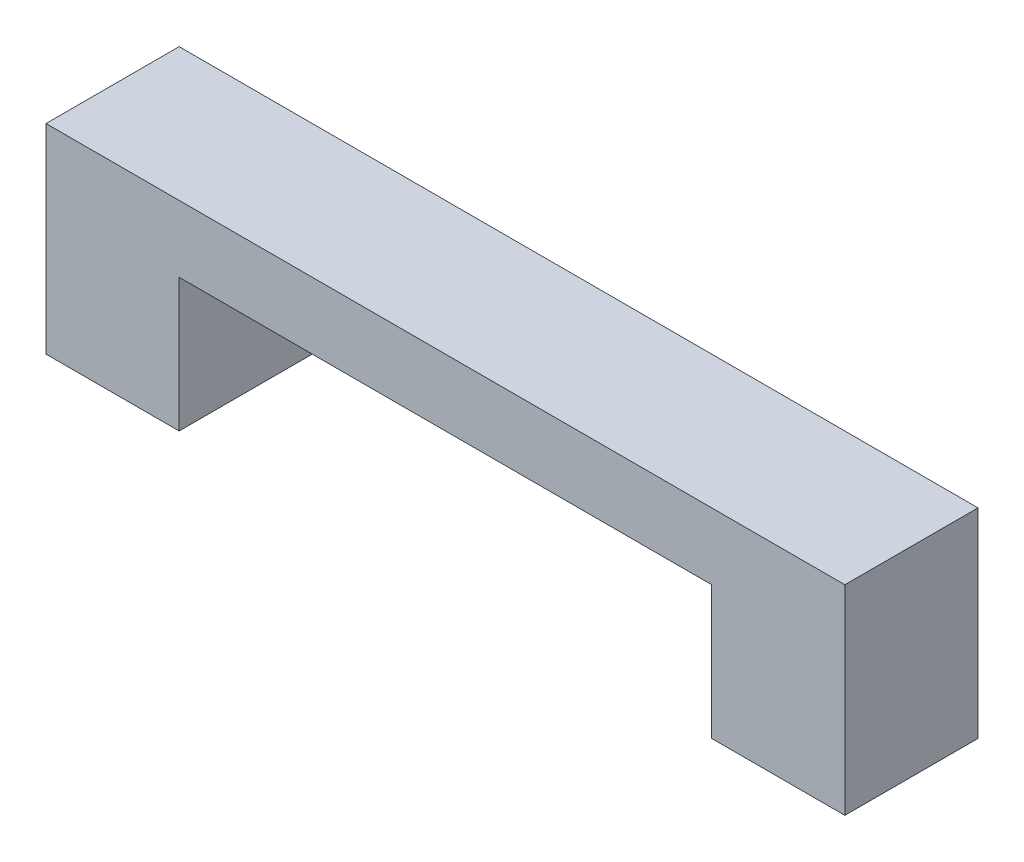
from build123d import *

# Parameters (mm, degrees)
BOSS_EXTRU_1_DEPTH = 2


with BuildPart() as part:
    # Esquisse1 → Boss.-Extru.1 (new body)
    with BuildSketch(Plane.XY):
        Polygon((0, 0), (-2, 0), (-2, 3), (10, 3), (10, 0), (8, 0), (8, 2), (0, 2), align=None)
    extrude(amount=BOSS_EXTRU_1_DEPTH)


solid = part.part
